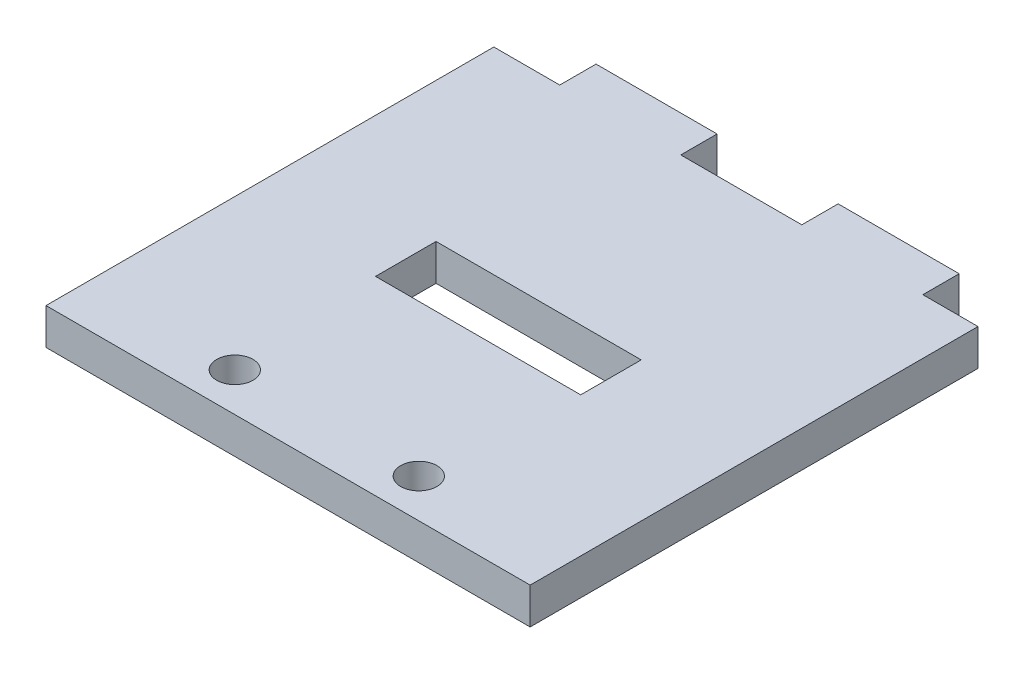
from build123d import *

# Parameters (mm, degrees)
SKETCH1_W           = 40
SKETCH1_H           = 40
BOSS_EXTRUDE1_DEPTH = 3
SKETCH2_R           = 1.5
SKETCH2_W           = 16.950963154
SKETCH2_H           = 5
CUT_EXTRUDE2_DEPTH  = 10
CUT_EXTRUDE3_DEPTH  = 10


with BuildPart() as part:
    # Sketch1 → Boss-Extrude1 (new body)
    with BuildSketch(Plane(origin=(0, 0, 0), x_dir=(1, 0, 0), z_dir=(0, 1, 0))):
        Rectangle(SKETCH1_W, SKETCH1_H)
    extrude(amount=BOSS_EXTRUDE1_DEPTH)

    # Sketch2 → Cut-Extrude2 (cut)
    with BuildSketch(Plane.XZ):
        with Locations(Location((7.6, 16.8, 0), (0, 0, 270))):
            Circle(SKETCH2_R)
        with Locations(Location((-7.6, 16.8, 0), (0, 0, 270))):
            Circle(SKETCH2_R)
        with Locations((0, 1.8)):
            Rectangle(SKETCH2_W, SKETCH2_H)
    extrude(amount=-CUT_EXTRUDE2_DEPTH, mode=Mode.SUBTRACT)

    # Sketch5 → Cut-Extrude3 (cut)
    with BuildSketch(Plane.XZ):
        Polygon((20, -17), (15.444490667, -17), (15.444490667, -20), (5.444490667, -20), (5.444490667, -17), (-4.555509333, -17), (-4.555509333, -20), (-14.555509333, -20), (-14.555509333, -17), (-20, -17), (-20, -21.558033771), (20, -21.558033771), align=None)
    extrude(amount=-CUT_EXTRUDE3_DEPTH, mode=Mode.SUBTRACT)


solid = part.part
